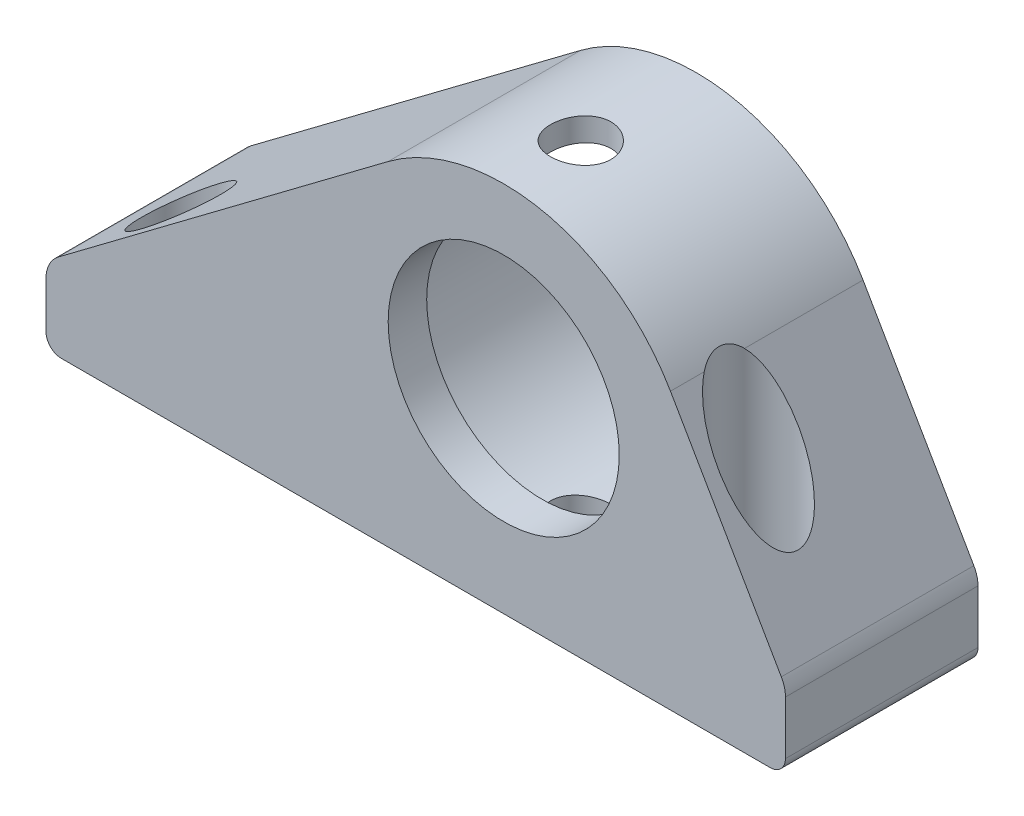
from build123d import *

# Parameters (mm, degrees)
SALIENTE_EXTRUIR1_DEPTH = 15.875
REDONDEO1_R             = 15.875
CORTAR_EXTRUIR1_REACH   = 48.084
CROQUIS2_R              = 9.525
CORTAR_EXTRUIR2_START   = -3.175
CROQUIS3_R              = 12.7
CORTAR_EXTRUIR2_DEPTH   = 43.909243503
CROQUIS4_R              = 3.2639
CROQUIS4_R_2            = 2.4892
CORTAR_EXTRUIR3_DEPTH   = 47.084243503
REDONDEO2_R             = 1.27
REDONDEO3_R             = 2.54


with BuildPart() as part:
    # Croquis1 → Saliente-Extruir1 (new body)
    with BuildSketch(Plane.XY):
        Polygon((30.48, 0), (-30.48, 0), (-30.48, 6.35), (12.046472996, 38.277805334), (30.48, 6.35), align=None)
    extrude(amount=SALIENTE_EXTRUIR1_DEPTH)

    # Redondeo1
    redondeo1_edges = [part.edges().sort_by_distance(p)[0] for p in [
        (12.046472996, 38.277805334, 7.9375),
    ]]
    fillet(redondeo1_edges, radius=REDONDEO1_R)

    # Croquis2 → Cortar-Extruir1 (cut, up to next)
    with BuildSketch(Plane.XY.offset(15.875), mode=Mode.PRIVATE) as cortar_extruir1_sk1:
        with Locations((7.254003, 16.09860686)):
            Circle(CROQUIS2_R)
    cortar_extruir1_tool1 = extrude(cortar_extruir1_sk1.sketch, amount=-CORTAR_EXTRUIR1_REACH, mode=Mode.PRIVATE) & part.part
    add(cortar_extruir1_tool1.solids().sort_by_distance((7.254003, 16.098607, 15.875))[0], mode=Mode.SUBTRACT)

    # Croquis3 → Cortar-Extruir2 (cut, through all)
    with BuildSketch(Plane.XY.offset(15.875).offset(CORTAR_EXTRUIR2_START)):
        with Locations((7.254003, 16.09860686)):
            Circle(CROQUIS3_R)
    extrude(amount=-CORTAR_EXTRUIR2_DEPTH, mode=Mode.SUBTRACT)

    # Croquis4 → Cortar-Extruir3 (cut, through all)
    with BuildSketch(Plane.XZ):
        with Locations((-23.8125, 11.43)):
            Circle(CROQUIS4_R)
        with Locations(Location((23.8125, 11.43, 0), (0, 0, 210.56660833))):
            Circle(CROQUIS4_R)
        with Locations((7.254003, 9.525)):
            Circle(CROQUIS4_R_2)
    extrude(amount=-CORTAR_EXTRUIR3_DEPTH, mode=Mode.SUBTRACT)

    # Redondeo2
    redondeo2_edges = [part.edges().sort_by_distance(p)[0] for p in [
        (30.48, 0, 7.9375),
        (-30.48, 0, 7.9375),
    ]]
    fillet(redondeo2_edges, radius=REDONDEO2_R)

    # Redondeo3
    redondeo3_edges = [part.edges().sort_by_distance(p)[0] for p in [
        (-30.48, 6.35, 7.9375),
        (30.48, 6.35, 7.9375),
    ]]
    fillet(redondeo3_edges, radius=REDONDEO3_R)


solid = part.part
